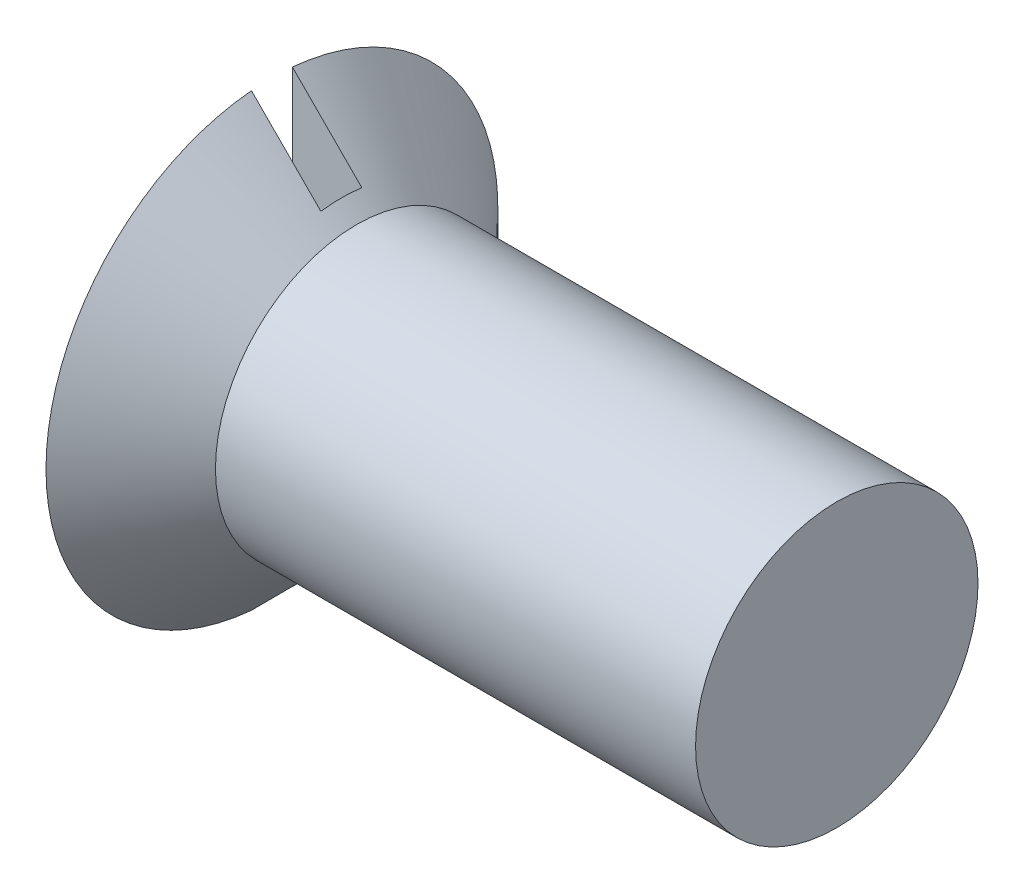
from build123d import *

# Parameters (mm, degrees)
SKETCH2_W          = 3.119119432
SKETCH2_H          = 0.920816202
CUT_EXTRUDE1_DEPTH = 7.874


with BuildPart() as part:
    # Sketch1 → Revolve1 (revolve)
    with BuildSketch(Plane.XY, mode=Mode.PRIVATE) as revolve1_sk:
        Polygon((0, 0), (12.7, 0), (12.7, 3.175), (1.905, 3.175), (0, 5.08), align=None)
    revolve(revolve1_sk.sketch.rotate(Axis((0, 0, 0), (1, 0, 0)), 90), axis=Axis((0, 0, 0), (1, 0, 0)))

    # Sketch2 → Cut-Extrude1 (cut, symmetric)
    with BuildSketch(Plane(origin=(0, 0, 0), x_dir=(1, 0, 0), z_dir=(0, 1, 0))):
        Rectangle(SKETCH2_W, SKETCH2_H)
    extrude(amount=CUT_EXTRUDE1_DEPTH, both=True, mode=Mode.SUBTRACT)


solid = part.part
